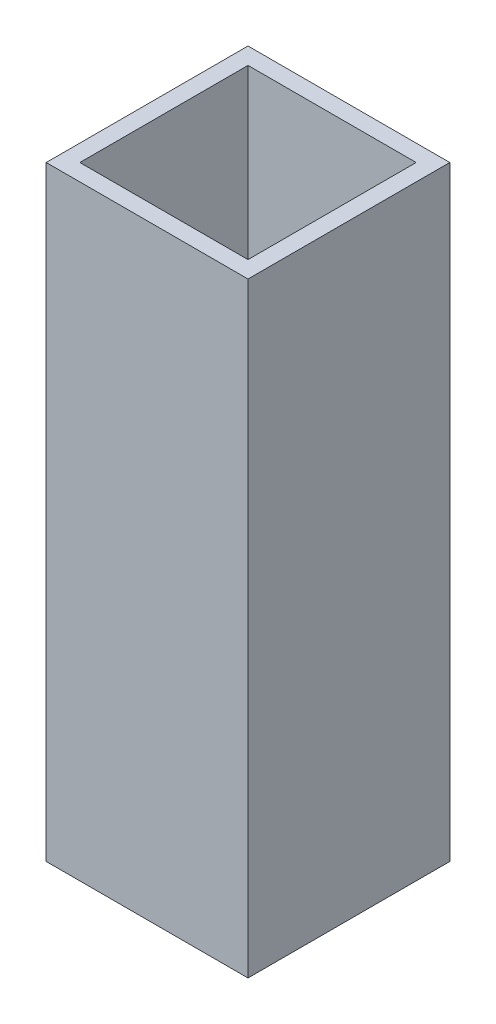
from build123d import *

# Parameters (mm, degrees)
SKETCH1_W           = 76.2
SKETCH1_H           = 228.6
BOSS_EXTRUDE1_DEPTH = 76.2
SHELL1_T            = -6.35


with BuildPart() as part:
    # Sketch1 → Boss-Extrude1 (new body)
    with BuildSketch(Plane(origin=(0, 0, 0), x_dir=(0, 0, -1), z_dir=(1, 0, 0))):
        with Locations((38.1, 114.3)):
            Rectangle(SKETCH1_W, SKETCH1_H)
    extrude(amount=BOSS_EXTRUDE1_DEPTH)

    # Shell1
    shell1_openings = [part.faces().sort_by_distance(p)[0] for p in [
        (38.1, 228.6, -38.1),
    ]]
    offset(amount=SHELL1_T, openings=shell1_openings, kind=Kind.INTERSECTION)


solid = part.part
